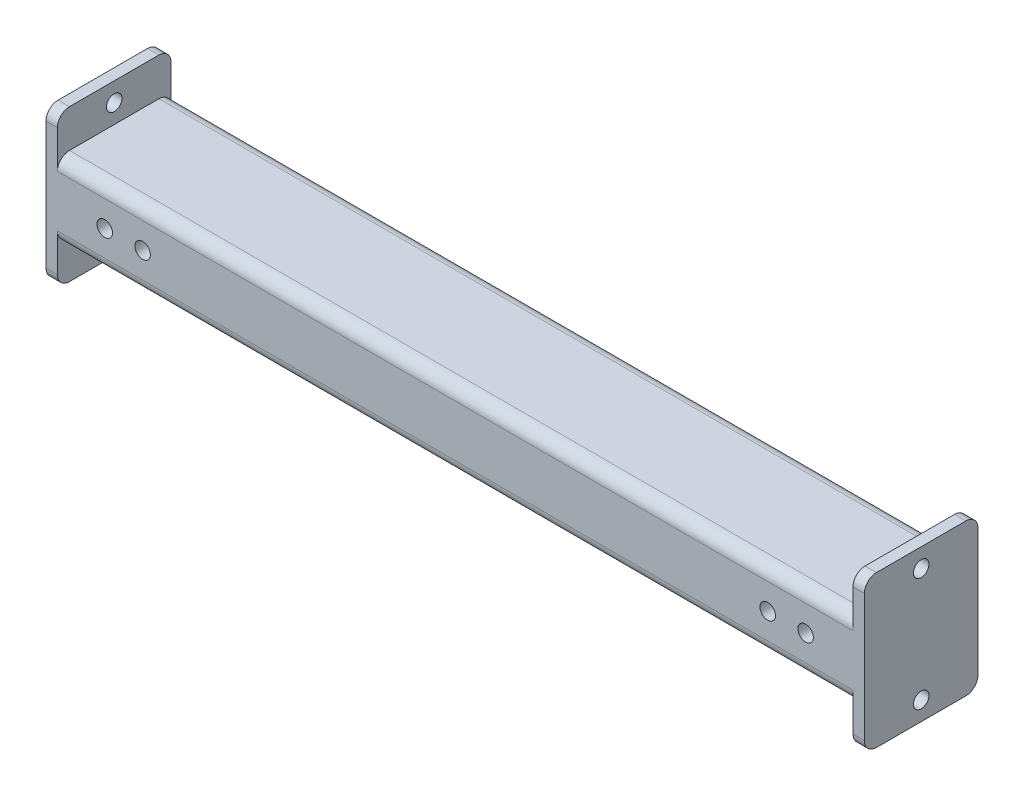
from build123d import *

# Parameters (mm, degrees)
DODANIE_WYCI_GNI_CIE2_DEPTH = 420
SZKIC4_R                    = 4.1
DODANIE_WYCI_GNI_CIE3_DEPTH = 6
DODANIE_WYCI_GNI_CIE4_REACH = 434.06
SZKIC5_R                    = 8.1
SZKIC5_R_2                  = 4.1
SZKIC6_R                    = 4.1
WYTNIJ_WYCI_GNI_CIE1_DEPTH  = 433.060180993


with BuildPart() as part:
    # Szkic3 → Dodanie-wyciągnięcie2 (new body)
    with BuildSketch(Plane(origin=(0, 0, 0), x_dir=(0, 0, -1), z_dir=(1, 0, 0))):
        with BuildLine():
            Line((-23.6, -20), (23.6, -20))
            ThreePointArc((23.6, -20), (28.1254834, -18.1254834), (30, -13.6))
            Line((30, -13.6), (30, 13.6))
            ThreePointArc((30, 13.6), (28.1254834, 18.1254834), (23.6, 20))
            Line((23.6, 20), (-23.6, 20))
            ThreePointArc((-23.6, 20), (-28.1254834, 18.1254834), (-30, 13.6))
            Line((-30, 13.6), (-30, -13.6))
            ThreePointArc((-30, -13.6), (-28.1254834, -18.1254834), (-23.6, -20))
        make_face()
        with BuildLine():
            Line((-17.6, 14), (17.6, 14))
            ThreePointArc((17.6, 14), (22.1254834, 12.1254834), (24, 7.6))
            Line((24, 7.6), (24, -7.6))
            ThreePointArc((24, -7.6), (22.1254834, -12.1254834), (17.6, -14))
            Line((17.6, -14), (-17.6, -14))
            ThreePointArc((-17.6, -14), (-22.1254834, -12.1254834), (-24, -7.6))
            Line((-24, -7.6), (-24, 7.6))
            ThreePointArc((-24, 7.6), (-22.1254834, 12.1254834), (-17.6, 14))
        make_face(mode=Mode.SUBTRACT)
    extrude(amount=DODANIE_WYCI_GNI_CIE2_DEPTH)

    # Szkic4 → Dodanie-wyciągnięcie3 (add)
    with BuildSketch(Plane(origin=(420, 0, 0), x_dir=(0, 0, -1), z_dir=(1, 0, 0))):
        with BuildLine():
            Line((-23.6, -40), (23.6, -40))
            ThreePointArc((23.6, -40), (28.1254834, -38.1254834), (30, -33.6))
            Line((30, -33.6), (30, 33.6))
            ThreePointArc((30, 33.6), (28.1254834, 38.1254834), (23.6, 40))
            Line((23.6, 40), (-23.6, 40))
            ThreePointArc((-23.6, 40), (-28.1254834, 38.1254834), (-30, 33.6))
            Line((-30, 33.6), (-30, -33.6))
            ThreePointArc((-30, -33.6), (-28.1254834, -38.1254834), (-23.6, -40))
        make_face()
        with Locations((0, 30)):
            Circle(SZKIC4_R, mode=Mode.SUBTRACT)
        with Locations(Location((0, -30, 0), (0, 0, 180))):
            Circle(SZKIC4_R, mode=Mode.SUBTRACT)
    dodanie_wyci_gni_cie3 = extrude(amount=DODANIE_WYCI_GNI_CIE3_DEPTH)

    # Szkic5 → Dodanie-wyciągnięcie4 (add, up to next)
    with BuildSketch(Plane.XY.offset(30), mode=Mode.PRIVATE) as dodanie_wyci_gni_cie4_sk1:
        with Locations(Location((25, 0, 0), (0, 0, 69.763291811))):
            Circle(SZKIC5_R)
        with Locations((25, 0)):
            Circle(SZKIC5_R_2, mode=Mode.SUBTRACT)
    dodanie_wyci_gni_cie4_tool1 = extrude(dodanie_wyci_gni_cie4_sk1.sketch, amount=-DODANIE_WYCI_GNI_CIE4_REACH, mode=Mode.PRIVATE) - part.part
    # Szkic5 → Dodanie-wyciągnięcie4 (add, up to next)
    with BuildSketch(Plane.XY.offset(30), mode=Mode.PRIVATE) as dodanie_wyci_gni_cie4_sk2:
        with Locations(Location((45, 0, 0), (0, 0, 69.763291811))):
            Circle(SZKIC5_R)
        with Locations((45, 0)):
            Circle(SZKIC5_R_2, mode=Mode.SUBTRACT)
    dodanie_wyci_gni_cie4_tool2 = extrude(dodanie_wyci_gni_cie4_sk2.sketch, amount=-DODANIE_WYCI_GNI_CIE4_REACH, mode=Mode.PRIVATE) - part.part
    dodanie_wyci_gni_cie4_1 = dodanie_wyci_gni_cie4_tool1.solids().sort_by_distance((22.277461, -7.38504, 30))[0]
    add(dodanie_wyci_gni_cie4_1)
    dodanie_wyci_gni_cie4_2 = dodanie_wyci_gni_cie4_tool2.solids().sort_by_distance((42.277461, -7.38504, 30))[0]
    add(dodanie_wyci_gni_cie4_2)
    dodanie_wyci_gni_cie4 = dodanie_wyci_gni_cie4_1 + dodanie_wyci_gni_cie4_2  # Dodanie-wyciągnięcie4 as one shape, for the pattern or mirror that repeats it

    # Szkic6 → Wytnij-wyciągnięcie1 (cut, through all)
    with BuildSketch(Plane.XY.offset(30)):
        with Locations((25, 0)):
            Circle(SZKIC6_R)
        with Locations((45, 0)):
            Circle(SZKIC6_R)
    wytnij_wyci_gni_cie1 = extrude(amount=-WYTNIJ_WYCI_GNI_CIE1_DEPTH, mode=Mode.SUBTRACT)

    # Lustro3: Dodanie-wyciągnięcie4, Wytnij-wyciągnięcie1 across plane
    add(dodanie_wyci_gni_cie4.mirror(Plane(origin=(210, 0, 0), x_dir=(0, 0, 1), z_dir=(1, 0, 0))))
    add(wytnij_wyci_gni_cie1.mirror(Plane(origin=(210, 0, 0), x_dir=(0, 0, 1), z_dir=(1, 0, 0))), mode=Mode.SUBTRACT)

    # Lustro4: Dodanie-wyciągnięcie3 across plane
    add(dodanie_wyci_gni_cie3.mirror(Plane(origin=(210, 0, 0), x_dir=(0, 0, 1), z_dir=(1, 0, 0))))


solid = part.part
